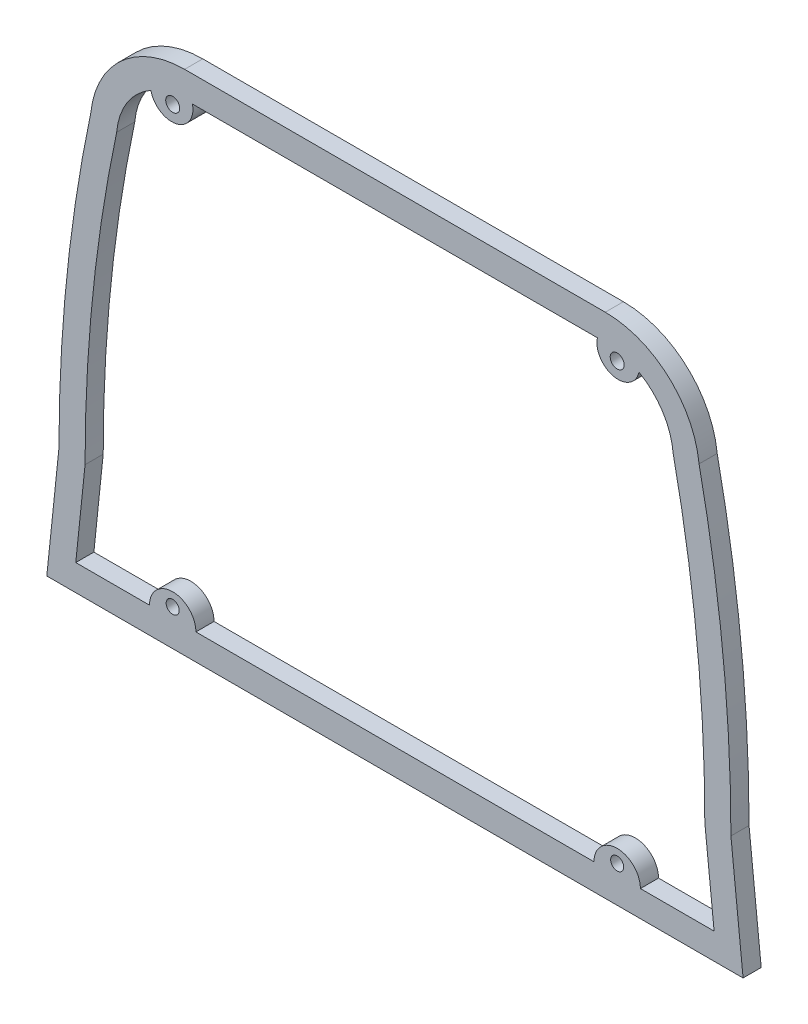
from build123d import *

# Parameters (mm, degrees)
SKETCH1_R           = 0.6096
SKETCH1_R_2         = 0.5715
BOSS_EXTRUDE1_DEPTH = 1.5875


with BuildPart() as part:
    # Sketch1 → Boss-Extrude1 (new body)
    with BuildSketch(Plane.XY):
        with BuildLine():
            Line((30.48, -22.225), (29.415104476, -11.9888))
            ThreePointArc((29.415104476, -11.9888), (28.715873825, 1.490040556), (26.625688573, 14.824176893))
            ThreePointArc((26.625688573, 14.824176893), (23.941924767, 20.101731209), (18.415, 22.225))
            Line((18.415, 22.225), (-18.415, 22.225))
            ThreePointArc((-18.415, 22.225), (-23.941924767, 20.101731209), (-26.625688573, 14.824176893))
            ThreePointArc((-26.625688573, 14.824176893), (-28.715873825, 1.490040556), (-29.415104476, -11.9888))
            Line((-29.415104476, -11.9888), (-30.48, -22.225))
            Line((-30.48, -22.225), (30.48, -22.225))
        make_face()
        with BuildLine():
            Line((-17.725268352, 19.939), (17.725268352, 19.939))
            ThreePointArc((17.725268352, 19.939), (19.155271645, 17.728799653), (21.365471992, 19.158802947))
            ThreePointArc((21.365471992, 19.158802947), (23.441797038, 17.188737724), (24.362294321, 14.478577686))
            ThreePointArc((24.362294321, 14.478577686), (26.441646573, 1.258286409), (27.129050016, -12.106865432))
            Line((27.129050016, -12.106865432), (27.943845061, -19.939))
            Line((27.943845061, -19.939), (21.489528855, -19.939))
            ThreePointArc((21.489528855, -19.939), (19.457528855, -17.907), (17.425528855, -19.939))
            Line((17.425528855, -19.939), (-17.425528855, -19.939))
            ThreePointArc((-17.425528855, -19.939), (-19.457528855, -17.907), (-21.489528855, -19.939))
            Line((-21.489528855, -19.939), (-27.943845061, -19.939))
            Line((-27.943845061, -19.939), (-27.129050016, -12.106865432))
            ThreePointArc((-27.129050016, -12.106865432), (-26.441646573, 1.258286409), (-24.362294321, 14.478577686))
            ThreePointArc((-24.362294321, 14.478577686), (-23.441797038, 17.188737724), (-21.365471992, 19.158802947))
            ThreePointArc((-21.365471992, 19.158802947), (-19.155271645, 17.728799653), (-17.725268352, 19.939))
        make_face(mode=Mode.SUBTRACT)
        with Locations((19.457528855, 19.05)):
            Circle(SKETCH1_R, mode=Mode.SUBTRACT)
        with Locations((-19.457528855, 19.05)):
            Circle(SKETCH1_R, mode=Mode.SUBTRACT)
        with Locations((-19.457528855, -19.05)):
            Circle(SKETCH1_R_2, mode=Mode.SUBTRACT)
        with Locations((19.457528855, -19.05)):
            Circle(SKETCH1_R_2, mode=Mode.SUBTRACT)
    extrude(amount=BOSS_EXTRUDE1_DEPTH)


solid = part.part
